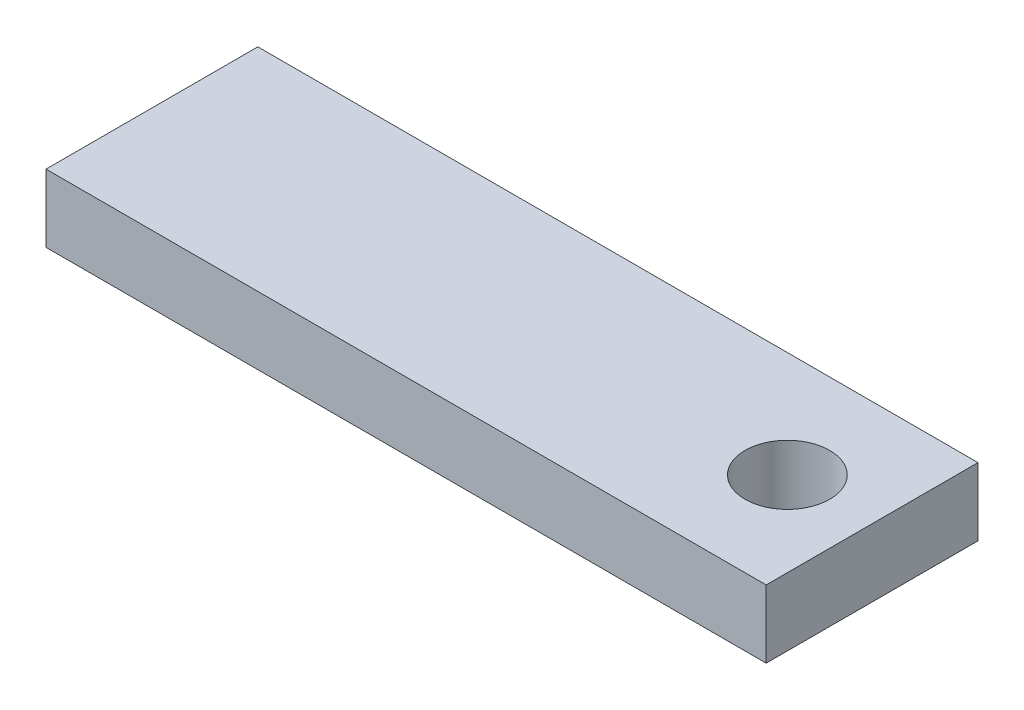
from build123d import *

# Parameters (mm, degrees)
ESQUISSE1_W        = 17
ESQUISSE1_H        = 5
ESQUISSE1_R        = 1
BOSS_EXTRU_1_DEPTH = 1.6


with BuildPart() as part:
    # Esquisse1 → Boss.-Extru.1 (new body)
    with BuildSketch(Plane(origin=(0, 0, 0), x_dir=(1, 0, 0), z_dir=(0, 1, 0))):
        with Locations((8.5, 2.5)):
            Rectangle(ESQUISSE1_W, ESQUISSE1_H)
        with Locations(Location((15, 2.5, 0), (0, 0, 270))):
            Circle(ESQUISSE1_R, mode=Mode.SUBTRACT)
    extrude(amount=BOSS_EXTRU_1_DEPTH)


solid = part.part
